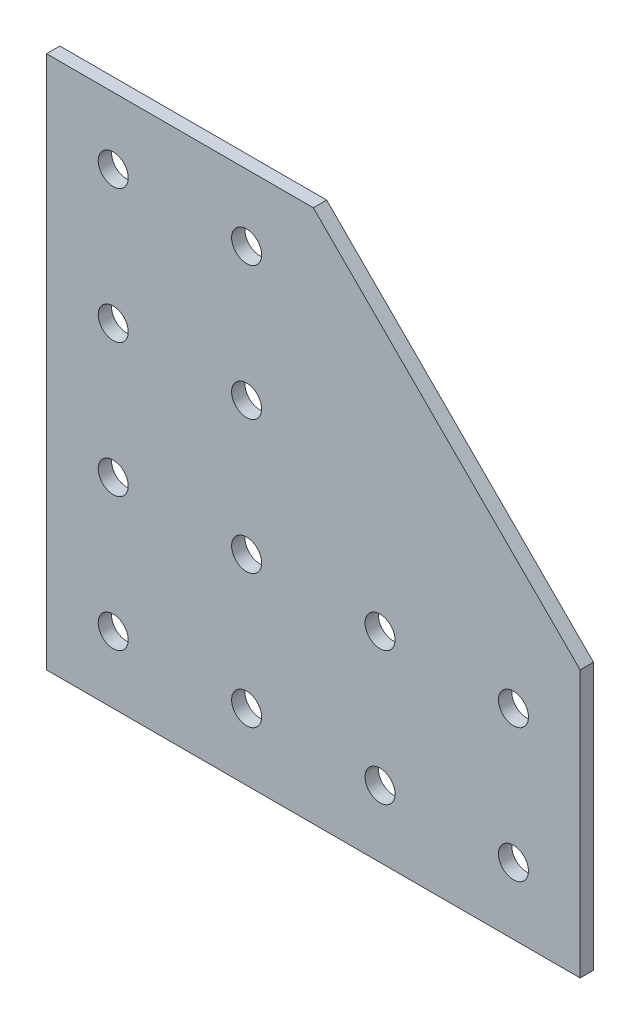
from build123d import *

# Parameters (mm, degrees)
EXTRUDE_1_DEPTH       = 2
HOLE_WIZARD_M41_D     = 4.5
HOLE_WIZARD_M41_DEPTH = 5
HOLE_WIZARD_M41_TIP   = 1.351936393


with BuildPart() as part:
    # Эскиз1 → Бобышка-Вытянуть1 (new body)
    with BuildSketch(Plane.XY):
        Polygon((0, 0), (0, 80), (40, 80), (80, 40), (80, 0), align=None)
    extrude(amount=EXTRUDE_1_DEPTH)

    # Отверстие с зазором M41
    with Locations(Plane(origin=(0, 0, 0), x_dir=(-1, 0, 0), z_dir=(0, 0, -1))):
        with Locations((-70, 10), (-30, 50), (-50, 10), (-10, 50), (-70, 30), (-30, 70), (-50, 30), (-10, 70), (-30, 10), (-10, 10), (-30, 30), (-10, 30)):
            Hole(HOLE_WIZARD_M41_D / 2, depth=HOLE_WIZARD_M41_DEPTH)
            with Locations((0, 0, -(HOLE_WIZARD_M41_DEPTH + HOLE_WIZARD_M41_TIP / 2))):  # 118° drill point
                Cone(0, HOLE_WIZARD_M41_D / 2, HOLE_WIZARD_M41_TIP, mode=Mode.SUBTRACT)


solid = part.part
